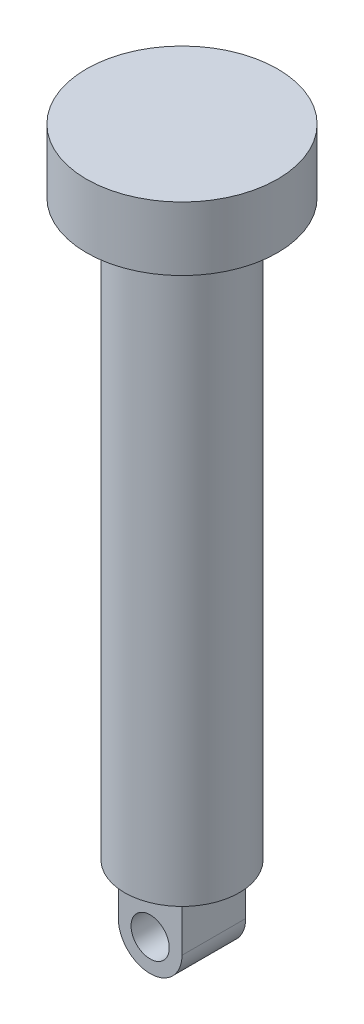
from build123d import *

# Parameters (mm, degrees)
SKETCH1_R           = 15
BOSS_EXTRUDE1_DEPTH = 10
SKETCH1_3_R         = 9
BOSS_EXTRUDE2_DEPTH = 90
SKETCH2_R           = 3
BOSS_EXTRUDE3_DEPTH = 5


with BuildPart() as part:
    # Sketch1 → Boss-Extrude1 (new body)
    with BuildSketch(Plane(origin=(0, 0, 0), x_dir=(1, 0, 0), z_dir=(0, 1, 0))):
        Circle(SKETCH1_R)
    extrude(amount=BOSS_EXTRUDE1_DEPTH)

    # Sketch1<3> → Boss-Extrude2 (add)
    with BuildSketch(Plane(origin=(0, 0, 0), x_dir=(1, 0, 0), z_dir=(0, 1, 0))):
        Circle(SKETCH1_3_R)
    extrude(amount=-BOSS_EXTRUDE2_DEPTH)

    # Sketch2 → Boss-Extrude3 (add, symmetric)
    with BuildSketch(Plane.XY):
        with BuildLine():
            Line((-5, -90), (-5, -98))
            ThreePointArc((-5, -98), (0, -103), (5, -98))
            Line((5, -98), (5, -90))
            Line((5, -90), (-5, -90))
        make_face()
        with Locations((0, -98)):
            Circle(SKETCH2_R, mode=Mode.SUBTRACT)
    extrude(amount=BOSS_EXTRUDE3_DEPTH, both=True)


solid = part.part
